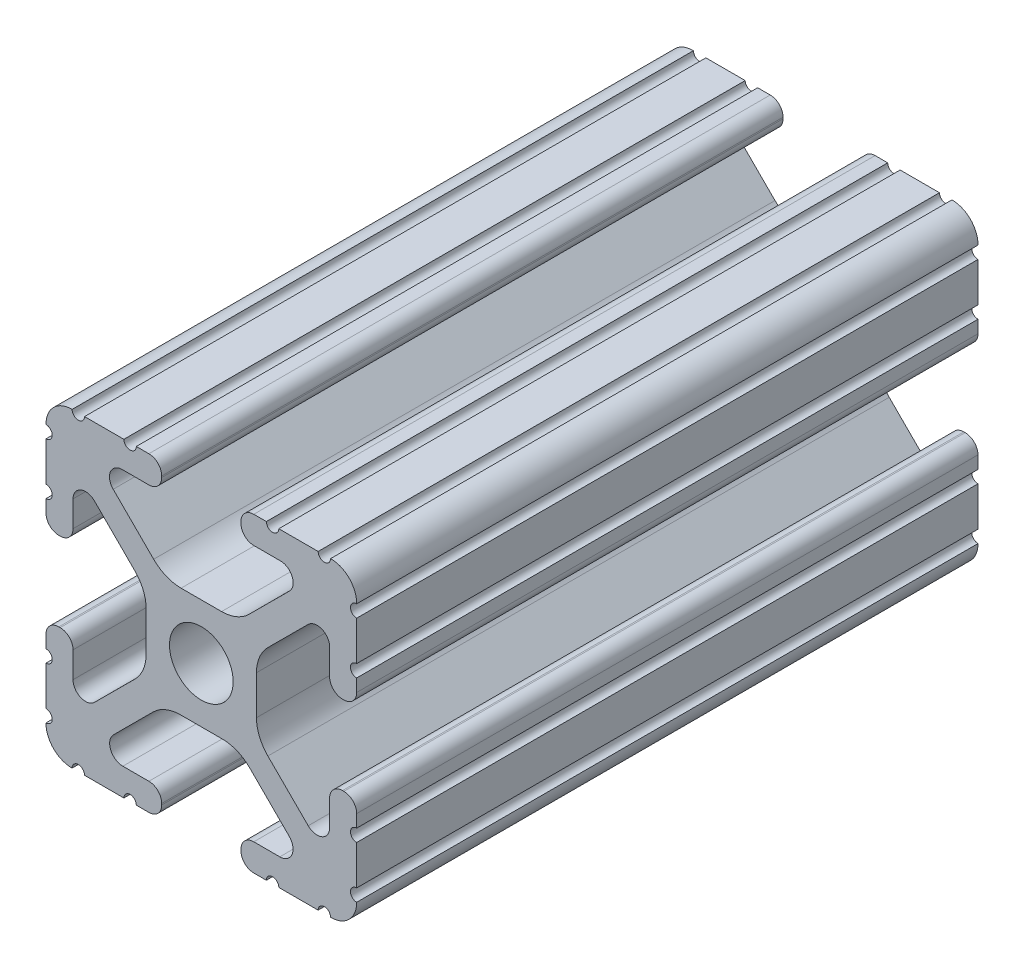
from build123d import *

# Parameters (mm, degrees)
SKETCH1_R      = 2.6035
EXTRUDE1_DEPTH = 50.8


with BuildPart() as part:
    # Sketch1 → Extrude1 (new body)
    with BuildSketch(Plane.XY):
        with BuildLine():
            Line((-7.207036008, 8.724370562), (-3.898272566, 5.423169045))
            ThreePointArc((-3.898272566, 5.423169045), (-2.869120213, 4.736787962), (-1.655778399, 4.4958))
            Line((-1.655778399, 4.4958), (1.655778399, 4.4958))
            ThreePointArc((1.655778399, 4.4958), (2.869120213, 4.736787962), (3.898272566, 5.423169045))
            Line((3.898272566, 5.423169045), (7.207036008, 8.724370562))
            ThreePointArc((7.207036008, 8.724370562), (7.432222385, 9.85140422), (6.476788598, 10.4902))
            Line((6.476788598, 10.4902), (4.287512407, 10.4902))
            ThreePointArc((4.287512407, 10.4902), (3.54574862, 10.79744862), (3.2385, 11.539212407))
            Line((3.2385, 11.539212407), (3.2385, 11.650987593))
            ThreePointArc((3.2385, 11.650987593), (3.54574862, 12.39275138), (4.287512407, 12.7))
            Line((4.287512407, 12.7), (5.317126718, 12.7))
            ThreePointArc((5.317126718, 12.7), (5.825126718, 12.192), (6.333126718, 12.7))
            Line((6.333126718, 12.7), (9.550443118, 12.7))
            ThreePointArc((9.550443118, 12.7), (10.058366869, 12.192000006), (10.566443095, 12.699847501))
            ThreePointArc((10.566443095, 12.699847501), (12.082537762, 12.08250727), (12.699846982, 10.566399977))
            ThreePointArc((12.699846982, 10.566399977), (12.192000006, 10.058323491), (12.7, 9.5504))
            Line((12.7, 9.5504), (12.7, 6.3330836))
            ThreePointArc((12.7, 6.3330836), (12.192, 5.8250836), (12.7, 5.3170836))
            Line((12.7, 5.3170836), (12.7, 4.287469289))
            ThreePointArc((12.7, 4.287469289), (12.39275138, 3.545705502), (11.650987593, 3.238456882))
            Line((11.650987593, 3.238456882), (11.539212407, 3.238456882))
            ThreePointArc((11.539212407, 3.238456882), (10.79744862, 3.545705502), (10.4902, 4.287469289))
            Line((10.4902, 4.287469289), (10.4902, 6.402089023))
            ThreePointArc((10.4902, 6.402089023), (9.856505071, 7.351067942), (8.737131347, 7.129408934))
            Line((8.737131347, 7.129408934), (5.441005833, 3.840816462))
            ThreePointArc((5.441005833, 3.840816462), (4.750877967, 2.809883091), (4.5085, 1.593185507))
            Line((4.5085, 1.593185507), (4.5085, -1.593185507))
            ThreePointArc((4.5085, -1.593185507), (4.750877967, -2.809883091), (5.441005833, -3.840816462))
            Line((5.441005833, -3.840816462), (8.737131347, -7.129408934))
            ThreePointArc((8.737131347, -7.129408934), (9.856505071, -7.351067942), (10.4902, -6.402089023))
            Line((10.4902, -6.402089023), (10.4902, -4.287469289))
            ThreePointArc((10.4902, -4.287469289), (10.79744862, -3.545705502), (11.539212407, -3.238456882))
            Line((11.539212407, -3.238456882), (11.650987593, -3.238456882))
            ThreePointArc((11.650987593, -3.238456882), (12.39275138, -3.545705502), (12.7, -4.287469289))
            Line((12.7, -4.287469289), (12.7, -5.3170836))
            ThreePointArc((12.7, -5.3170836), (12.192, -5.8250836), (12.7, -6.3330836))
            Line((12.7, -6.3330836), (12.7, -9.5504))
            ThreePointArc((12.7, -9.5504), (12.192000006, -10.058323491), (12.699846982, -10.566399977))
            ThreePointArc((12.699846982, -10.566399977), (12.082537762, -12.08250727), (10.566443095, -12.699847501))
            ThreePointArc((10.566443095, -12.699847501), (10.058366869, -12.192000006), (9.550443118, -12.7))
            Line((9.550443118, -12.7), (6.333126718, -12.7))
            ThreePointArc((6.333126718, -12.7), (5.825126718, -12.192), (5.317126718, -12.7))
            Line((5.317126718, -12.7), (4.287512407, -12.7))
            ThreePointArc((4.287512407, -12.7), (3.54574862, -12.39275138), (3.2385, -11.650987593))
            Line((3.2385, -11.650987593), (3.2385, -11.539212407))
            ThreePointArc((3.2385, -11.539212407), (3.54574862, -10.79744862), (4.287512407, -10.4902))
            Line((4.287512407, -10.4902), (6.416408329, -10.4902))
            ThreePointArc((6.416408329, -10.4902), (7.41473083, -9.822813117), (7.179650497, -8.645192506))
            Line((7.179650497, -8.645192506), (3.952270251, -5.423690499))
            ThreePointArc((3.952270251, -5.423690499), (2.922936451, -4.736929036), (1.709253557, -4.4958))
            Line((1.709253557, -4.4958), (-1.709253557, -4.4958))
            ThreePointArc((-1.709253557, -4.4958), (-2.922936451, -4.736929036), (-3.952270251, -5.423690499))
            Line((-3.952270251, -5.423690499), (-7.179650497, -8.645192506))
            ThreePointArc((-7.179650497, -8.645192506), (-7.41473083, -9.822813117), (-6.416408329, -10.4902))
            Line((-6.416408329, -10.4902), (-4.287512407, -10.4902))
            ThreePointArc((-4.287512407, -10.4902), (-3.54574862, -10.79744862), (-3.2385, -11.539212407))
            Line((-3.2385, -11.539212407), (-3.2385, -11.650987593))
            ThreePointArc((-3.2385, -11.650987593), (-3.54574862, -12.39275138), (-4.287512407, -12.7))
            Line((-4.287512407, -12.7), (-5.317126718, -12.7))
            ThreePointArc((-5.317126718, -12.7), (-5.825126718, -12.192), (-6.333126718, -12.7))
            Line((-6.333126718, -12.7), (-9.550443118, -12.7))
            ThreePointArc((-9.550443118, -12.7), (-10.058366869, -12.192000006), (-10.566443095, -12.699847501))
            ThreePointArc((-10.566443095, -12.699847501), (-12.082537762, -12.08250727), (-12.699846982, -10.566399977))
            ThreePointArc((-12.699846982, -10.566399977), (-12.192000006, -10.058323491), (-12.7, -9.5504))
            Line((-12.7, -9.5504), (-12.7, -6.3330836))
            ThreePointArc((-12.7, -6.3330836), (-12.192, -5.8250836), (-12.7, -5.3170836))
            Line((-12.7, -5.3170836), (-12.7, -4.287469289))
            ThreePointArc((-12.7, -4.287469289), (-12.39275138, -3.545705502), (-11.650987593, -3.238456882))
            Line((-11.650987593, -3.238456882), (-11.539212407, -3.238456882))
            ThreePointArc((-11.539212407, -3.238456882), (-10.79744862, -3.545705502), (-10.4902, -4.287469289))
            Line((-10.4902, -4.287469289), (-10.4902, -6.402089023))
            ThreePointArc((-10.4902, -6.402089023), (-9.856505071, -7.351067942), (-8.737131347, -7.129408934))
            Line((-8.737131347, -7.129408934), (-5.441005833, -3.840816462))
            ThreePointArc((-5.441005833, -3.840816462), (-4.750877967, -2.809883091), (-4.5085, -1.593185507))
            Line((-4.5085, -1.593185507), (-4.5085, 1.593185507))
            ThreePointArc((-4.5085, 1.593185507), (-4.750877967, 2.809883091), (-5.441005833, 3.840816462))
            Line((-5.441005833, 3.840816462), (-8.737131347, 7.129408934))
            ThreePointArc((-8.737131347, 7.129408934), (-9.856505071, 7.351067942), (-10.4902, 6.402089023))
            Line((-10.4902, 6.402089023), (-10.4902, 4.287469289))
            ThreePointArc((-10.4902, 4.287469289), (-10.79744862, 3.545705502), (-11.539212407, 3.238456882))
            Line((-11.539212407, 3.238456882), (-11.650987593, 3.238456882))
            ThreePointArc((-11.650987593, 3.238456882), (-12.39275138, 3.545705502), (-12.7, 4.287469289))
            Line((-12.7, 4.287469289), (-12.7, 5.3170836))
            ThreePointArc((-12.7, 5.3170836), (-12.192, 5.8250836), (-12.7, 6.3330836))
            Line((-12.7, 6.3330836), (-12.7, 9.5504))
            ThreePointArc((-12.7, 9.5504), (-12.192000006, 10.058323491), (-12.699846982, 10.566399977))
            ThreePointArc((-12.699846982, 10.566399977), (-12.082537762, 12.08250727), (-10.566443095, 12.699847501))
            ThreePointArc((-10.566443095, 12.699847501), (-10.058366869, 12.192000006), (-9.550443118, 12.7))
            Line((-9.550443118, 12.7), (-6.333126718, 12.7))
            ThreePointArc((-6.333126718, 12.7), (-5.825126718, 12.192), (-5.317126718, 12.7))
            Line((-5.317126718, 12.7), (-4.287512407, 12.7))
            ThreePointArc((-4.287512407, 12.7), (-3.54574862, 12.39275138), (-3.2385, 11.650987593))
            Line((-3.2385, 11.650987593), (-3.2385, 11.539212407))
            ThreePointArc((-3.2385, 11.539212407), (-3.54574862, 10.79744862), (-4.287512407, 10.4902))
            Line((-4.287512407, 10.4902), (-6.476788598, 10.4902))
            ThreePointArc((-6.476788598, 10.4902), (-7.432222385, 9.85140422), (-7.207036008, 8.724370562))
        make_face()
        Circle(SKETCH1_R, mode=Mode.SUBTRACT)
    extrude(amount=-EXTRUDE1_DEPTH)


solid = part.part
